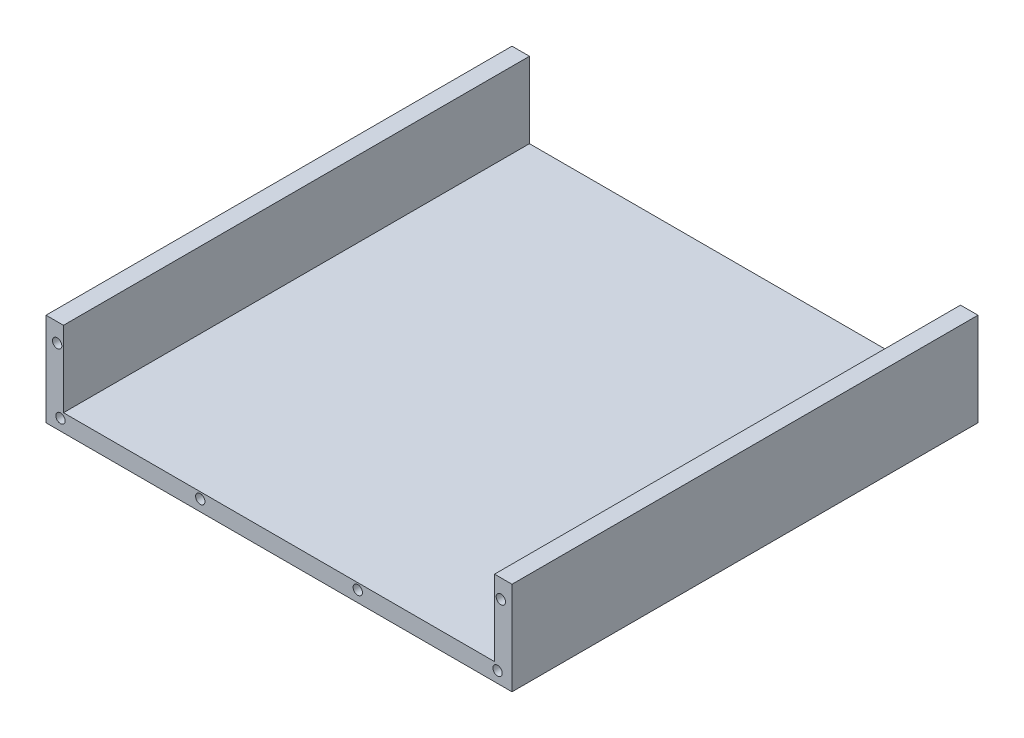
from build123d import *

# Parameters (mm, degrees)
BOSS_EXTRUDE2_DEPTH = 63.5
SKETCH4_R           = 1.27
CUT_EXTRUDE1_DEPTH  = 2.54
CUT_EXTRUDE2_START  = -2.54
SKETCH5_R           = 1.27
CUT_EXTRUDE2_DEPTH  = 2.54


with BuildPart() as part:
    # Sketch3 → Boss-Extrude2 (new, symmetric)
    with BuildSketch(Plane.XY):
        Polygon((-63.5, 12.7), (-63.5, -12.7), (63.5, -12.7), (63.5, 12.7), (58.7375, 12.7), (58.7375, -7.9375), (-58.7375, -7.9375), (-58.7375, 12.7), align=None)
    extrude(amount=BOSS_EXTRUDE2_DEPTH, both=True)

    # Sketch4 → Cut-Extrude1 (cut)
    with BuildSketch(Plane.XY.offset(63.5)):
        with Locations((-60.452, 7.62)):
            Circle(SKETCH4_R)
        with Locations(Location((59.563, -9.652, 0), (0, 0, 180))):
            Circle(SKETCH4_R)
        with Locations((60.452, 7.62)):
            Circle(SKETCH4_R)
        with Locations((-21.463, -9.652)):
            Circle(SKETCH4_R)
        with Locations((21.463, -9.652)):
            Circle(SKETCH4_R)
        with Locations((-59.563, -9.652)):
            Circle(SKETCH4_R)
    extrude(amount=-CUT_EXTRUDE1_DEPTH, mode=Mode.SUBTRACT)

    # Sketch5 → Cut-Extrude2 (cut)
    with BuildSketch(Plane(origin=(0, 0, -63.5), x_dir=(-1, 0, 0), z_dir=(0, 0, -1)).offset(CUT_EXTRUDE2_START)):
        with Locations((-59.563, -9.652)):
            Circle(SKETCH5_R)
        with Locations(Location((-60.452, 7.62, 0), (0, 0, 180))):
            Circle(SKETCH5_R)
        with Locations(Location((-21.463, -9.652, 0), (0, 0, 180))):
            Circle(SKETCH5_R)
        with Locations(Location((21.463, -9.652, 0), (0, 0, 180))):
            Circle(SKETCH5_R)
        with Locations(Location((60.452, 7.62, 0), (0, 0, 180))):
            Circle(SKETCH5_R)
        with Locations(Location((59.563, -9.652, 0), (0, 0, 180))):
            Circle(SKETCH5_R)
    extrude(amount=CUT_EXTRUDE2_DEPTH, mode=Mode.SUBTRACT)


solid = part.part
